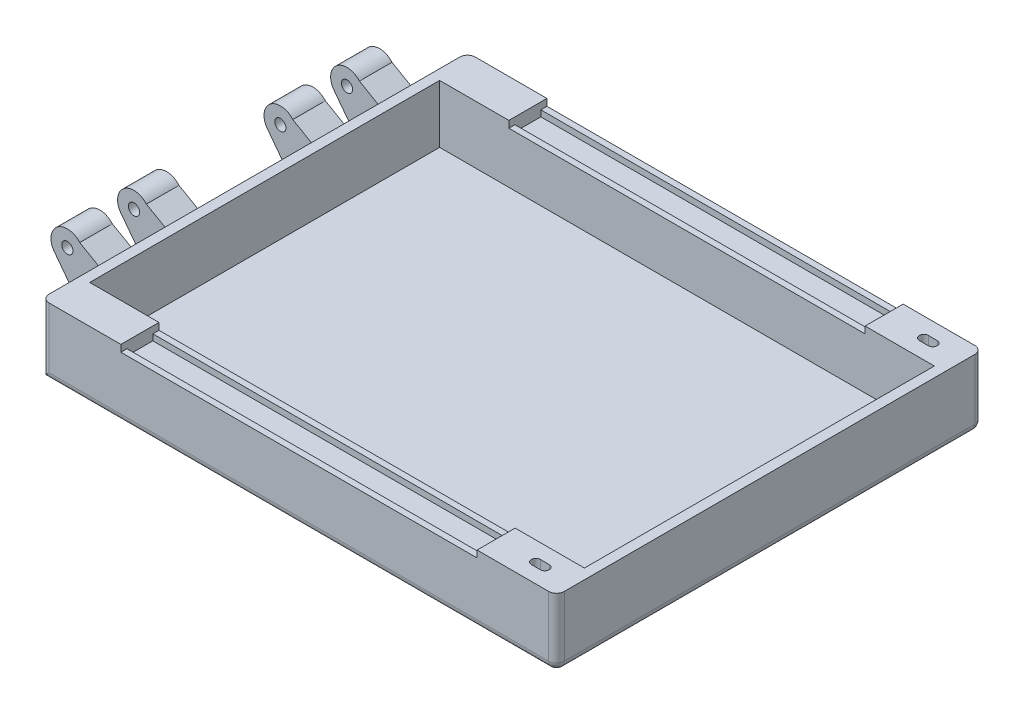
from build123d import *

# Parameters (mm, degrees)
SKETCH1_W               = 253.04
SKETCH1_H               = 209.32
BOSS_EXTRUDE1_DEPTH     = 33.5
SKETCH2_W               = 243.04
SKETCH2_H               = 171.92
CUT_EXTRUDE1_DEPTH      = 28.5
SKETCH4_W               = 175
SKETCH4_H               = 18.7
CUT_EXTRUDE2_DEPTH      = 3.35
SKETCH5_W               = 175
SKETCH5_H               = 12.7
CUT_EXTRUDE3_DEPTH      = 3
SKETCH6_W               = 175
SKETCH6_H               = 18.7
CUT_EXTRUDE4_DEPTH      = 3.35
SKETCH7_W               = 175
SKETCH7_H               = 12.7
CUT_EXTRUDE5_DEPTH      = 3
SKETCH9_R               = 2.75
BOSS_EXTRUDE2_DEPTH     = 8
MIRROR2_COPY_1_SKETCH_R = 2.75
MIRROR2_COPY_1_DEPTH    = 8
CUT_EXTRUDE6_DEPTH      = 33.5
FILLET3_R               = 3.81


with BuildPart() as part:
    # Sketch1 → Boss-Extrude1 (new body)
    with BuildSketch(Plane(origin=(0, 0, 0), x_dir=(1, 0, 0), z_dir=(0, 1, 0))):
        Rectangle(SKETCH1_W, SKETCH1_H)
    extrude(amount=BOSS_EXTRUDE1_DEPTH)

    # Sketch2 → Cut-Extrude1 (cut)
    with BuildSketch(Plane(origin=(0, 33.5, 0), x_dir=(1, 0, 0), z_dir=(0, 1, 0))):
        Rectangle(SKETCH2_W, SKETCH2_H)
    extrude(amount=-CUT_EXTRUDE1_DEPTH, mode=Mode.SUBTRACT)

    # Sketch4 → Cut-Extrude2 (cut)
    with BuildSketch(Plane(origin=(0, 33.5, 0), x_dir=(1, 0, 0), z_dir=(0, 1, 0))):
        with Locations((0, -95.31)):
            Rectangle(SKETCH4_W, SKETCH4_H)
    extrude(amount=-CUT_EXTRUDE2_DEPTH, mode=Mode.SUBTRACT)

    # Sketch5 → Cut-Extrude3 (cut)
    with BuildSketch(Plane(origin=(0, 30.15, 0), x_dir=(1, 0, 0), z_dir=(0, 1, 0))):
        with Locations((0, -95.31)):
            Rectangle(SKETCH5_W, SKETCH5_H)
    extrude(amount=-CUT_EXTRUDE3_DEPTH, mode=Mode.SUBTRACT)

    # Sketch6 → Cut-Extrude4 (cut)
    with BuildSketch(Plane(origin=(0, 33.5, 0), x_dir=(1, 0, 0), z_dir=(0, 1, 0))):
        with Locations((0, 95.31)):
            Rectangle(SKETCH6_W, SKETCH6_H)
    extrude(amount=-CUT_EXTRUDE4_DEPTH, mode=Mode.SUBTRACT)

    # Sketch7 → Cut-Extrude5 (cut)
    with BuildSketch(Plane(origin=(0, 30.15, 0), x_dir=(1, 0, 0), z_dir=(0, 1, 0))):
        with Locations((0, 95.31)):
            Rectangle(SKETCH7_W, SKETCH7_H)
    extrude(amount=-CUT_EXTRUDE5_DEPTH, mode=Mode.SUBTRACT)

    # Sketch9 → Boss-Extrude2 (add, symmetric)
    with BuildSketch(Plane.XY.offset(-35.96)):
        with BuildLine():
            Line((-126.52, 0), (-147.855407805, 28.241815551))
            ThreePointArc((-147.855407805, 28.241815551), (-147.018184449, 39.595407805), (-135.664592195, 38.758184449))
            Line((-135.664592195, 38.758184449), (-126.52, 33.5))
            Line((-126.52, 33.5), (-126.52, 0))
        make_face()
        with Locations((-141.76, 33.5)):
            Circle(SKETCH9_R, mode=Mode.SUBTRACT)
    boss_extrude2 = extrude(amount=BOSS_EXTRUDE2_DEPTH, both=True)

    # Mirror1: Boss-Extrude2 across plane
    add(boss_extrude2.mirror(Plane.XY.offset(-52.33)))

    # Mirror2: Boss-Extrude2 across plane
    add(boss_extrude2.mirror(Plane.XY))

    # Mirror2 copy 1 sketch → Mirror2 copy 1 (add, symmetric)
    with BuildSketch(Plane.XY.offset(68.7)):
        with BuildLine():
            Line((-126.52, 0), (-147.855407805, 28.241815551))
            ThreePointArc((-147.855407805, 28.241815551), (-147.018184449, 39.595407805), (-135.664592195, 38.758184449))
            Line((-135.664592195, 38.758184449), (-126.52, 33.5))
            Line((-126.52, 33.5), (-126.52, 0))
        make_face()
        with Locations((-141.76, 33.5)):
            Circle(MIRROR2_COPY_1_SKETCH_R, mode=Mode.SUBTRACT)
    extrude(amount=MIRROR2_COPY_1_DEPTH, both=True)

    # Sketch11 → Cut-Extrude6 (cut)
    with BuildSketch(Plane(origin=(0, 33.5, 0), x_dir=(1, 0, 0), z_dir=(0, 1, 0))):
        with BuildLine():
            Line((107.01, 93.11), (111.410002543, 93.11))
            ThreePointArc((111.410002543, 93.11), (113.610001272, 95.310001272), (111.41, 97.51))
            Line((111.41, 97.51), (107.01, 97.51))
            ThreePointArc((107.01, 97.51), (104.81, 95.31), (107.01, 93.11))
        make_face()
    cut_extrude6 = extrude(amount=-CUT_EXTRUDE6_DEPTH, mode=Mode.SUBTRACT)

    # Mirror3: Cut-Extrude6 across plane
    add(cut_extrude6.mirror(Plane.XY), mode=Mode.SUBTRACT)

    # Fillet3
    fillet3_edges = [part.edges().sort_by_distance(p)[0] for p in [
        (0, 0, 104.66),
        (0, 0, -104.66),
        (126.52, 0, 0),
        (126.52, 16.75, 104.66),
        (-126.52, 16.75, 104.66),
        (-126.52, 16.75, -104.66),
        (126.52, 16.75, -104.66),
    ]]
    fillet(fillet3_edges, radius=FILLET3_R)


solid = part.part
